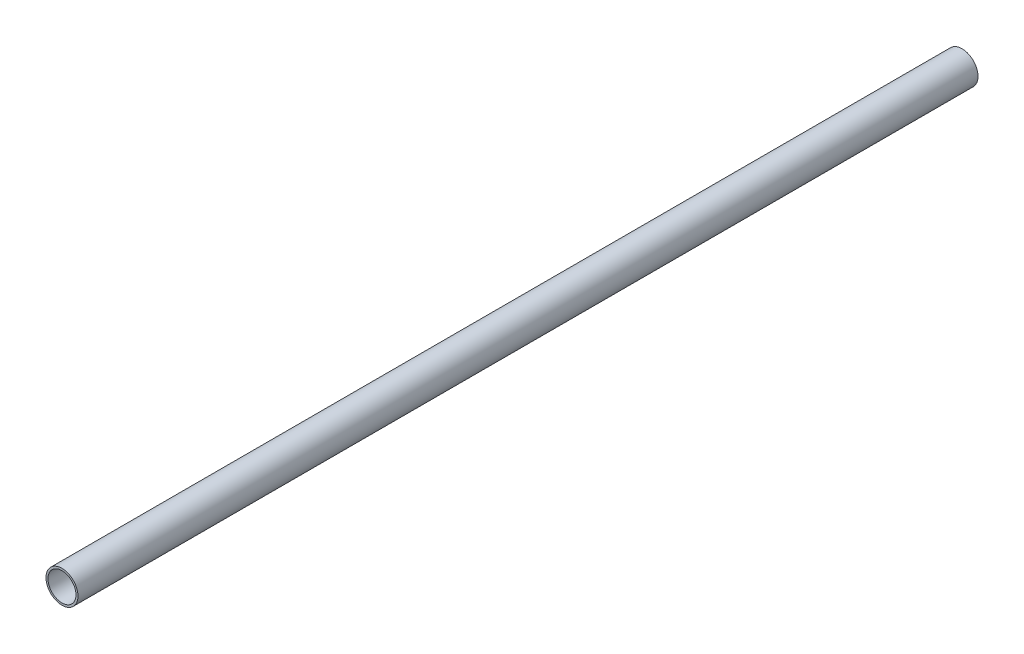
from build123d import *

# Parameters (mm, degrees)
SKETCH1_R           = 8
SKETCH1_R_2         = 7
EXTRUDE_THIN1_DEPTH = 450


with BuildPart() as part:
    # Sketch1 → Extrude-Thin1 (new body)
    with BuildSketch(Plane.XY):
        Circle(SKETCH1_R)
        Circle(SKETCH1_R_2, mode=Mode.SUBTRACT)
    extrude(amount=EXTRUDE_THIN1_DEPTH)


solid = part.part
